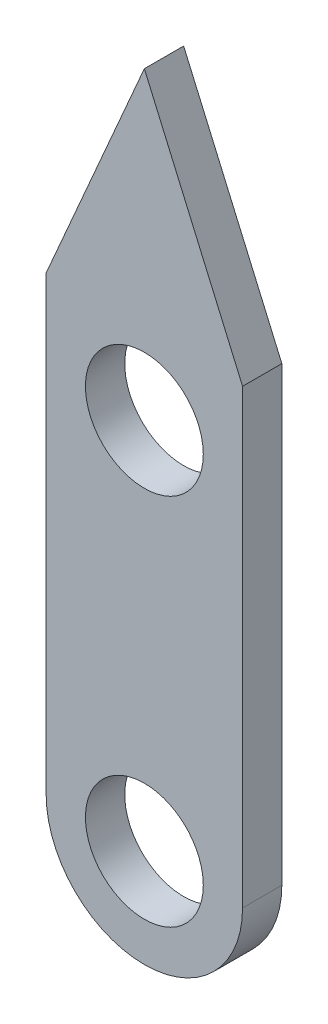
from build123d import *

# Parameters (mm, degrees)
SKETCH_1_R      = 3
EXTRUDE_1_DEPTH = 2


with BuildPart() as part:
    # 草图1 → 凸台-拉伸1 (new body)
    with BuildSketch(Plane.XY):
        with BuildLine():
            Line((4.944222113, 9.446585585), (4.944222113, -9.553414415))
            ThreePointArc((4.944222113, -9.553414415), (-0.055777887, -14.553414415), (-5.055777887, -9.553414415))
            Line((-5.055777887, -9.553414415), (-5.055777887, 9.446585585))
            Line((-5.055777887, 9.446585585), (-5.055777887, 13.446585585))
            Line((-5.055777887, 13.446585585), (-0.055777887, 24.950641748))
            Line((-0.055777887, 24.950641748), (4.944222113, 13.446585585))
            Line((4.944222113, 13.446585585), (4.944222113, 9.446585585))
        make_face()
        with Locations((-0.055777887, 9.446585585)):
            Circle(SKETCH_1_R, mode=Mode.SUBTRACT)
        with Locations((-0.055777887, -9.553414415)):
            Circle(SKETCH_1_R, mode=Mode.SUBTRACT)
    extrude(amount=EXTRUDE_1_DEPTH)


solid = part.part
